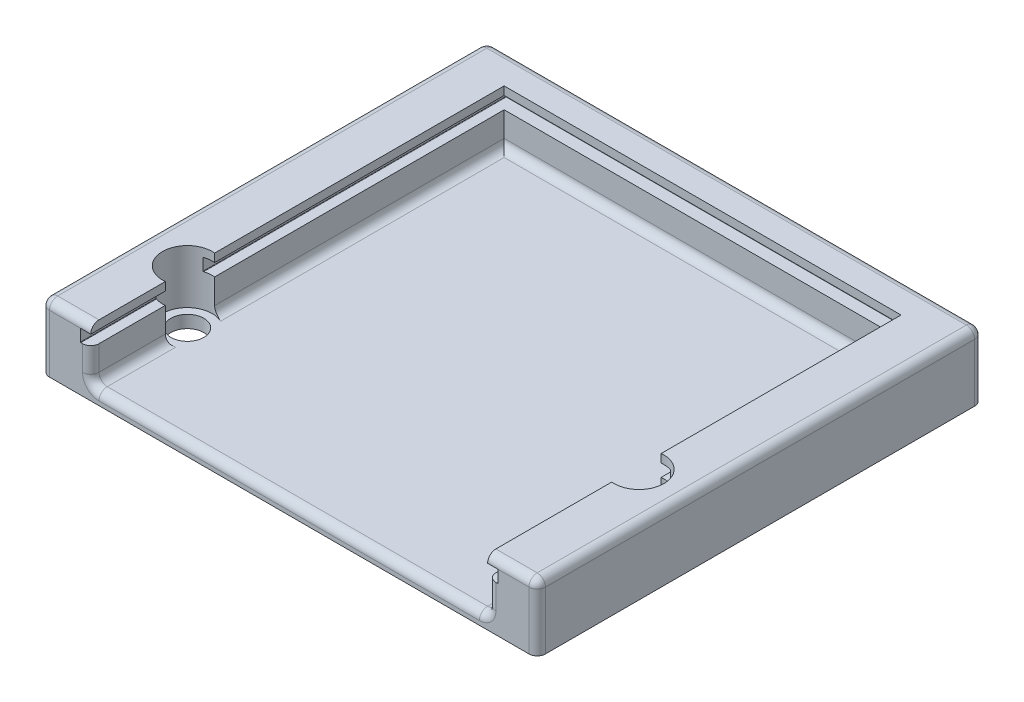
from build123d import *

# Parameters (mm, degrees)
BOSS_EXTRUDE1_DEPTH = 1.5
BOSS_EXTRUDE4_DEPTH = 8
SKETCH6_W           = 50
SKETCH6_H           = 1.5
CUT_EXTRUDE1_DEPTH  = 1.25
SKETCH10_W          = 50
SKETCH10_H          = 1.5
CUT_EXTRUDE2_DEPTH  = 1.25
SKETCH11_W          = 50.5
SKETCH11_H          = 1.5
CUT_EXTRUDE3_DEPTH  = 1.5
FILLET1_R           = 1
FILLET2_R           = 0.05


with BuildPart() as part:
    # Sketch2 → Boss-Extrude1 (new body)
    with BuildSketch(Plane(origin=(0, 0, 0), x_dir=(1, 0, 0), z_dir=(0, 1, 0))):
        with BuildLine():
            Line((6, 9.016650219), (6, 0))
            Line((6, 0), (54, 0))
            Line((54, 0), (54, 15.016650219))
            ThreePointArc((54, 15.016650219), (51.315632832, 18), (54, 20.983349781))
            Line((54, 20.983349781), (54, 50))
            Line((54, 50), (6, 50))
            Line((6, 50), (6, 14.983349781))
            ThreePointArc((6, 14.983349781), (7.914490315, 14.00662671), (8.684367168, 12))
            ThreePointArc((8.684367168, 12), (7.914490315, 9.99337329), (6, 9.016650219))
        make_face()
        with BuildLine():
            ThreePointArc((54, 20.983349781), (51.315632832, 18), (54, 15.016650219))
            Line((54, 15.016650219), (54, 16.02506306))
            ThreePointArc((54, 16.02506306), (52.315632832, 18), (54, 19.97493694))
            Line((54, 19.97493694), (54, 20.983349781))
        make_face()
        with BuildLine():
            Line((54, 16.02506306), (54, 15.016650219))
            ThreePointArc((54, 15.016650219), (56.322259541, 15.769876854), (57.315632832, 18))
            ThreePointArc((57.315632832, 18), (56.322259541, 20.230123146), (54, 20.983349781))
            Line((54, 20.983349781), (54, 19.97493694))
            ThreePointArc((54, 19.97493694), (55.61346455, 19.521720353), (56.315632832, 18))
            ThreePointArc((56.315632832, 18), (55.61346455, 16.478279647), (54, 16.02506306))
        make_face()
        with BuildLine():
            ThreePointArc((6, 14.983349781), (2.684367168, 12), (6, 9.016650219))
            Line((6, 9.016650219), (6, 10.02506306))
            ThreePointArc((6, 10.02506306), (3.684367168, 12), (6, 13.97493694))
            Line((6, 13.97493694), (6, 14.983349781))
        make_face()
        with BuildLine():
            Line((6, 10.02506306), (6, 9.016650219))
            ThreePointArc((6, 9.016650219), (7.914490315, 9.99337329), (8.684367168, 12))
            ThreePointArc((8.684367168, 12), (7.914490315, 14.00662671), (6, 14.983349781))
            Line((6, 14.983349781), (6, 13.97493694))
            ThreePointArc((6, 13.97493694), (7.206087521, 13.297831718), (7.684367168, 12))
            ThreePointArc((7.684367168, 12), (7.206087521, 10.702168282), (6, 10.02506306))
        make_face()
    extrude(amount=BOSS_EXTRUDE1_DEPTH)

    # Sketch2<7> → Boss-Extrude4 (add)
    with BuildSketch(Plane(origin=(0, 0, 0), x_dir=(1, 0, 0), z_dir=(0, 1, 0))):
        with BuildLine():
            Line((0, 0), (6, 0))
            Line((6, 0), (6, 9.016650219))
            ThreePointArc((6, 9.016650219), (2.684367168, 12), (6, 14.983349781))
            Line((6, 14.983349781), (6, 50))
            Line((6, 50), (54, 50))
            Line((54, 50), (54, 20.983349781))
            ThreePointArc((54, 20.983349781), (57.315632832, 18), (54, 15.016650219))
            Line((54, 15.016650219), (54, 0))
            Line((54, 0), (60, 0))
            Line((60, 0), (60, 53.896997513))
            Line((60, 53.896997513), (0, 53.896997513))
            Line((0, 53.896997513), (0, 0))
        make_face()
    extrude(amount=BOSS_EXTRUDE4_DEPTH)

    # Sketch6 → Cut-Extrude1 (cut)
    with BuildSketch(Plane(origin=(6, 0, 0), x_dir=(0, 0, -1), z_dir=(1, 0, 0))):
        with Locations((25, 6.25)):
            Rectangle(SKETCH6_W, SKETCH6_H)
    extrude(amount=-CUT_EXTRUDE1_DEPTH, mode=Mode.SUBTRACT)

    # Sketch10 → Cut-Extrude2 (cut)
    with BuildSketch(Plane.ZY.offset(-54)):
        with Locations((-25, 6.25)):
            Rectangle(SKETCH10_W, SKETCH10_H)
    extrude(amount=-CUT_EXTRUDE2_DEPTH, mode=Mode.SUBTRACT)

    # Sketch11 → Cut-Extrude3 (cut)
    with BuildSketch(Plane.XY.offset(-50)):
        with Locations((30, 6.25)):
            Rectangle(SKETCH11_W, SKETCH11_H)
    extrude(amount=-CUT_EXTRUDE3_DEPTH, mode=Mode.SUBTRACT)

    # Fillet1
    fillet1_edges = [part.edges().sort_by_distance(p)[0] for p in [
        (6, 1.5, -4.50832511),
        (6, 1.5, -32.49167489),
        (30, 1.5, -50),
        (54, 1.5, -35.49167489),
        (54, 1.5, -7.50832511),
        (30, 1.5, 0),
        (54, 3.5, 0),
        (6, 3.5, 0),
        (60, 4, -53.896997513),
        (0, 4, -53.896997513),
        (30, 8, -53.896997513),
        (0, 4, 0),
        (60, 4, 0),
        (60, 8, -26.948498756),
        (57, 8, 0),
        (3, 8, 0),
        (0, 8, -26.948498756),
    ]]
    fillet(fillet1_edges, radius=FILLET1_R)

    # Fillet2
    fillet2_edges = [part.edges().sort_by_distance(p)[0] for p in [
        (55.25, 7, -36.175390999),
        (55.25, 5.5, -7.574609001),
        (55.25, 7, -7.574609001),
        (55.25, 5.5, -36.175390999),
        (30, 7, -51.5),
        (30, 5.5, -51.5),
        (4.75, 7, -33.175390999),
        (4.75, 5.5, -4.574609001),
        (4.75, 7, -4.574609001),
        (4.75, 5.5, -33.175390999),
    ]]
    fillet(fillet2_edges, radius=FILLET2_R)


solid = part.part
